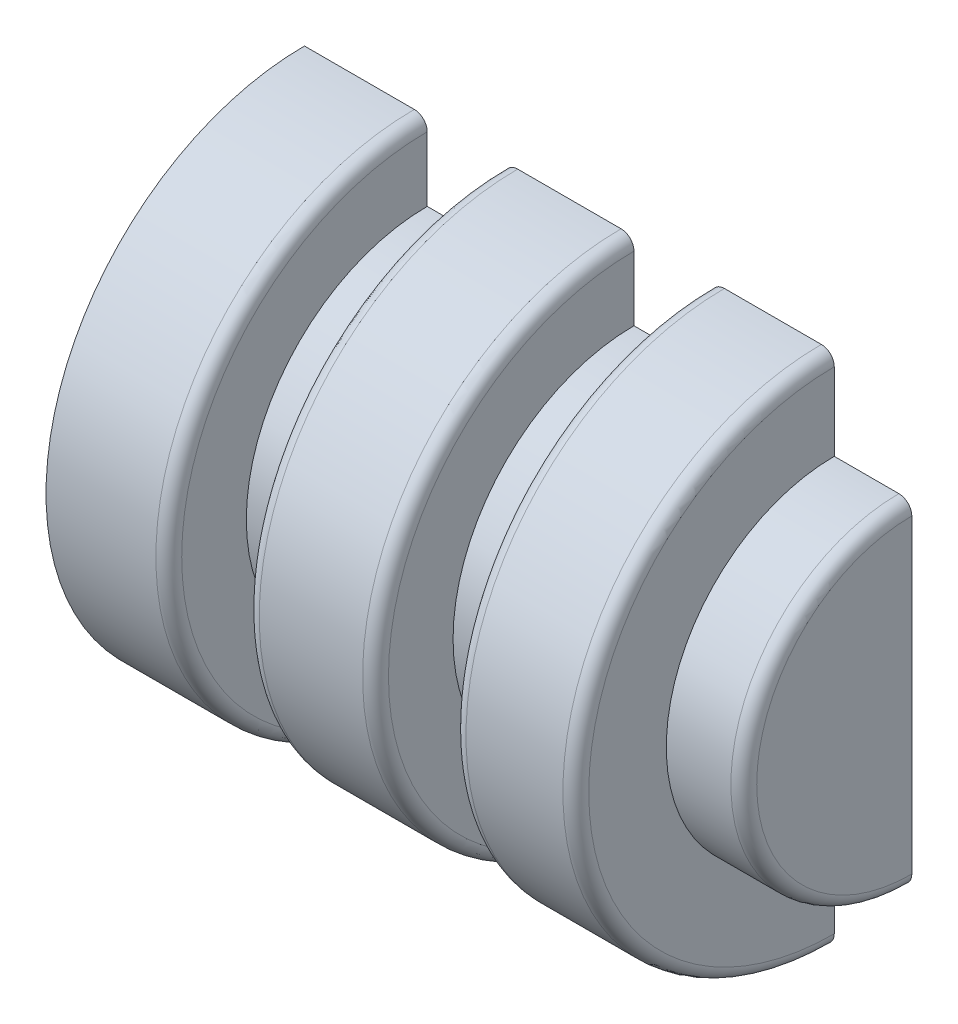
from build123d import *

# Parameters (mm, degrees)
SKETCH1_R           = 10
BOSS_EXTRUDE1_DEPTH = 4.75
SKETCH4_R           = 6.5
BOSS_EXTRUDE2_DEPTH = 3
SKETCH5_R           = 7
BOSS_EXTRUDE3_DEPTH = 3
FILLET1_R           = 0.5
BOSS_EXTRUDE4_START = 5
SKETCH6_R           = 10
BOSS_EXTRUDE4_DEPTH = 5
SKETCH7_R           = 7
BOSS_EXTRUDE5_DEPTH = 3
BOSS_EXTRUDE6_START = 4.75
SKETCH9_R           = 10
BOSS_EXTRUDE6_DEPTH = 4.75
FILLET2_R           = 0.5
SKETCH10_W          = 23.933386236
SKETCH10_H          = 20
CUT_EXTRUDE1_DEPTH  = 20
CUT_EXTRUDE2_DEPTH  = 5


with BuildPart() as part:
    # Sketch1 → Boss-Extrude1 (new body)
    with BuildSketch(Plane(origin=(0, 0, 0), x_dir=(0, 0, -1), z_dir=(1, 0, 0))):
        Circle(SKETCH1_R)
    extrude(amount=BOSS_EXTRUDE1_DEPTH)

    # Sketch4 → Boss-Extrude2 (add)
    with BuildSketch(Plane(origin=(4.75, 0, 0), x_dir=(0, 0, -1), z_dir=(1, 0, 0))):
        Circle(SKETCH4_R)
    extrude(amount=BOSS_EXTRUDE2_DEPTH)

    # Sketch5 → Boss-Extrude3 (add)
    with BuildSketch(Plane.ZY):
        with Locations(Location((0, 0, 0), (0, 0, 180))):
            Circle(SKETCH5_R)
    extrude(amount=BOSS_EXTRUDE3_DEPTH)

    # Fillet1
    fillet1_edges = [part.edges().sort_by_distance(p)[0] for p in [
        (7.75, 0, 6.5),
    ]]
    fillet(fillet1_edges, radius=FILLET1_R)

    # Sketch6 → Boss-Extrude4 (add)
    with BuildSketch(Plane.ZY.offset(3).offset(BOSS_EXTRUDE4_START)):
        with Locations(Location((0, 0, 0), (0, 0, 180))):
            Circle(SKETCH6_R)
    extrude(amount=-BOSS_EXTRUDE4_DEPTH)

    # Sketch7 → Boss-Extrude5 (add)
    with BuildSketch(Plane.ZY.offset(8)):
        with Locations(Location((0, 0, 0), (0, 0, 180))):
            Circle(SKETCH7_R)
    extrude(amount=BOSS_EXTRUDE5_DEPTH)

    # Sketch9 → Boss-Extrude6 (add)
    with BuildSketch(Plane.ZY.offset(11).offset(BOSS_EXTRUDE6_START)):
        with Locations(Location((0, 0, 0), (0, 0, 180))):
            Circle(SKETCH9_R)
    extrude(amount=-BOSS_EXTRUDE6_DEPTH)

    # Fillet2
    fillet2_edges = [part.edges().sort_by_distance(p)[0] for p in [
        (-3, 0, 10),
        (-8, 0, 10),
        (0, 0, 10),
        (-11, 0, 10),
        (4.75, 0, 10),
    ]]
    fillet(fillet2_edges, radius=FILLET2_R)

    # Sketch10 → Cut-Extrude1 (cut)
    with BuildSketch(Plane.XY):
        with Locations((-3.783306882, 0)):
            Rectangle(SKETCH10_W, SKETCH10_H)
    extrude(amount=-CUT_EXTRUDE1_DEPTH, mode=Mode.SUBTRACT)

    # Sketch11 → Cut-Extrude2 (cut)
    with BuildSketch(Plane.ZY.offset(15.75)):
        with BuildLine():
            Line((0, 2.75), (0, -2.75))
            ThreePointArc((0, -2.75), (2.75, 0), (0, 2.75))
        make_face()
    extrude(amount=-CUT_EXTRUDE2_DEPTH, mode=Mode.SUBTRACT)


solid = part.part
